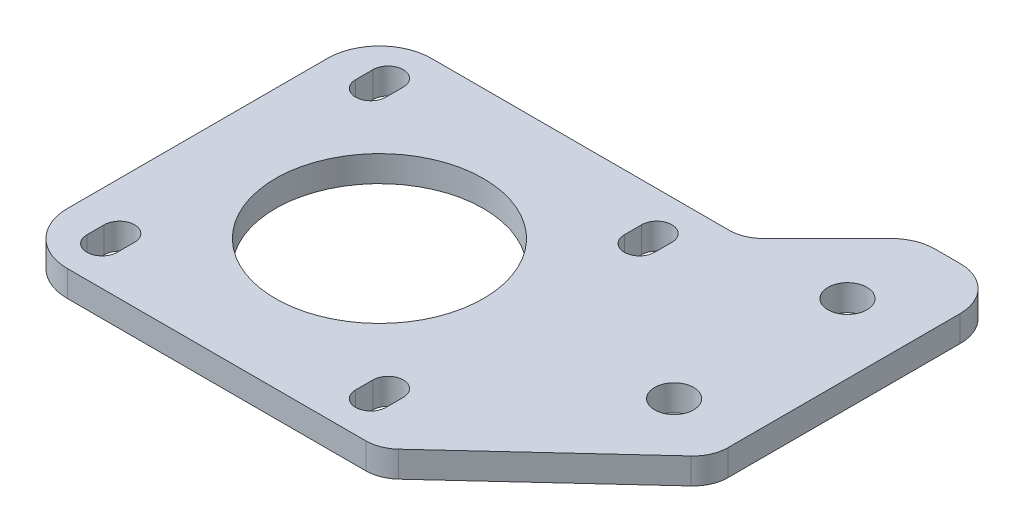
from build123d import *

# Parameters (mm, degrees)
CROQUIS1_R              = 12
CROQUIS1_R_2            = 2.25
SALIENTE_EXTRUIR1_DEPTH = 3


with BuildPart() as part:
    # Croquis1 → Saliente-Extruir1 (new body)
    with BuildSketch(Plane(origin=(0, -1.500057886, 0), x_dir=(1, 0, 0), z_dir=(0, 1, 0))):
        with BuildLine():
            Line((-284, -35), (-249.563216934, -35))
            ThreePointArc((-249.563216934, -35), (-248.107235492, -34.725603044), (-246.851012488, -33.94005902))
            Line((-246.851012488, -33.94005902), (-229.287795554, -17.737991398))
            ThreePointArc((-229.287795554, -17.737991398), (-228.336066473, -16.402797204), (-228, -14.797932378))
            Line((-228, -14.797932378), (-228, 12))
            ThreePointArc((-228, 12), (-229.464466094, 15.535533906), (-233, 17))
            Line((-233, 17), (-235.928932188, 17))
            ThreePointArc((-235.928932188, 17), (-237.84234935, 16.619397663), (-239.464466094, 15.535533906))
            Line((-239.464466094, 15.535533906), (-246.828427125, 8.171572875))
            ThreePointArc((-246.828427125, 8.171572875), (-248.12612052, 7.30448187), (-249.656854249, 7))
            Line((-249.656854249, 7), (-284, 7))
            ThreePointArc((-284, 7), (-288.242640687, 5.242640687), (-290, 1))
            Line((-290, 1), (-290, -29))
            ThreePointArc((-290, -29), (-288.242640687, -33.242640687), (-284, -35))
        make_face()
        with Locations(Location((-269, -14, 0), (0, 0, 90))):
            Circle(CROQUIS1_R, mode=Mode.SUBTRACT)
        with Locations(Location((-236, -13, 0), (0, 0, 90))):
            Circle(CROQUIS1_R_2, mode=Mode.SUBTRACT)
        with Locations(Location((-236, 7, 0), (0, 0, 90))):
            Circle(CROQUIS1_R_2, mode=Mode.SUBTRACT)
        with BuildLine():
            Line((-251.75, -28.5), (-251.75, -30.5))
            ThreePointArc((-251.75, -30.5), (-253.5, -32.25), (-255.25, -30.5))
            Line((-255.25, -30.5), (-255.25, -28.5))
            ThreePointArc((-255.25, -28.5), (-253.5, -26.75), (-251.75, -28.5))
        make_face(mode=Mode.SUBTRACT)
        with BuildLine():
            Line((-282.75, -28.5), (-282.75, -30.5))
            ThreePointArc((-282.75, -30.5), (-284.5, -32.25), (-286.25, -30.5))
            Line((-286.25, -30.5), (-286.25, -28.5))
            ThreePointArc((-286.25, -28.5), (-284.5, -26.75), (-282.75, -28.5))
        make_face(mode=Mode.SUBTRACT)
        with BuildLine():
            Line((-255.25, 0.5), (-255.25, 2.5))
            ThreePointArc((-255.25, 2.5), (-253.5, 4.25), (-251.75, 2.5))
            Line((-251.75, 2.5), (-251.75, 0.5))
            ThreePointArc((-251.75, 0.5), (-253.5, -1.25), (-255.25, 0.5))
        make_face(mode=Mode.SUBTRACT)
        with BuildLine():
            Line((-286.25, 0.5), (-286.25, 2.5))
            ThreePointArc((-286.25, 2.5), (-284.5, 4.25), (-282.75, 2.5))
            Line((-282.75, 2.5), (-282.75, 0.5))
            ThreePointArc((-282.75, 0.5), (-284.5, -1.25), (-286.25, 0.5))
        make_face(mode=Mode.SUBTRACT)
    extrude(amount=-SALIENTE_EXTRUIR1_DEPTH)


solid = part.part
